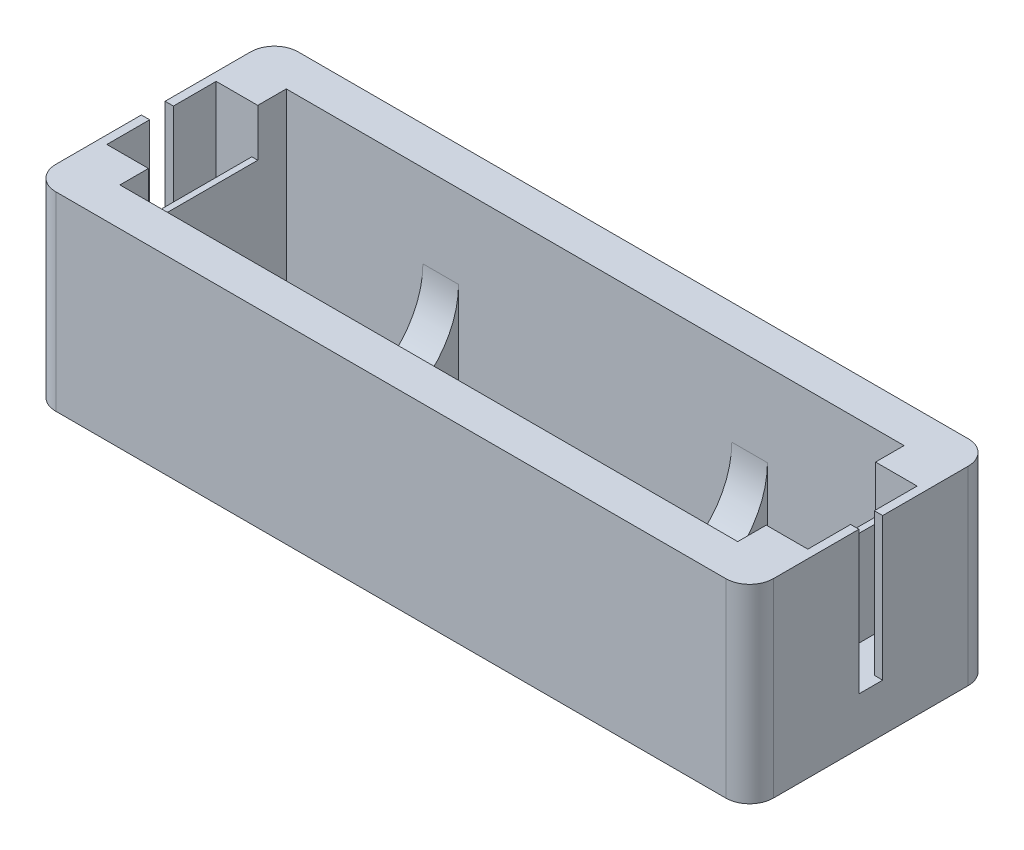
from build123d import *

# Parameters (mm, degrees)
SKETCH2_W                                  = 60.4
SKETCH2_H                                  = 20.4
BOSS_EXTRUDE1_DEPTH                        = 16
SKETCH3_W                                  = 52
SKETCH3_H                                  = 14
CUT_EXTRUDE1_DEPTH                         = 14
FILLET1_R                                  = 2
SKETCH4_W                                  = 0.5
SKETCH4_H                                  = 4.6
CUT_EXTRUDE2_DEPTH                         = 4
SKETCH5_W                                  = 3
SKETCH5_H                                  = 4.6
CUT_EXTRUDE3_DEPTH                         = 12
MIRROR5_COPY_1_SKETCH_W                    = 0.5
MIRROR5_COPY_1_SKETCH_H                    = 4.6
MIRROR5_COPY_1_DEPTH                       = 4
MIRROR5_COPY_2_SKETCH_W                    = 3
MIRROR5_COPY_2_SKETCH_H                    = 4.6
MIRROR5_COPY_2_DEPTH                       = 12
MIRROR5_COPY_3_SKETCH_W                    = 0.5
MIRROR5_COPY_3_SKETCH_H                    = 4.6
MIRROR5_COPY_3_DEPTH                       = 4
SKETCH8_W                                  = 3
SKETCH8_H                                  = 14
BOSS_EXTRUDE2_DEPTH                        = 7
CUT_EXTRUDE5_REACH                         = 49.183
SKETCH7_R                                  = 7
CUT_EXTRUDE5_DIRECTION_2_REACH             = 49.183
SKETCH9_W                                  = 0.7
SKETCH9_H                                  = 1
CUT_EXTRUDE6_DEPTH                         = 12
MIRROR8_AT_THE_SECOND_PLANE_COPY_1_SKETC_W = 0.7
MIRROR8_AT_THE_SECOND_PLANE_COPY_1_SKETC_H = 1
MIRROR8_AT_THE_SECOND_PLANE_COPY_1_DEPTH   = 12


with BuildPart() as part:
    # Sketch2 → Boss-Extrude1 (new body)
    with BuildSketch(Plane(origin=(0, 0, 0), x_dir=(1, 0, 0), z_dir=(0, 1, 0))):
        Rectangle(SKETCH2_W, SKETCH2_H)
    extrude(amount=BOSS_EXTRUDE1_DEPTH)

    # Sketch3 → Cut-Extrude1 (cut)
    with BuildSketch(Plane(origin=(0, 16, 0), x_dir=(1, 0, 0), z_dir=(0, 1, 0))):
        Rectangle(SKETCH3_W, SKETCH3_H)
    extrude(amount=-CUT_EXTRUDE1_DEPTH, mode=Mode.SUBTRACT)

    # Fillet1
    fillet1_edges = [part.edges().sort_by_distance(p)[0] for p in [
        (30.2, 8, 10.2),
        (-30.2, 8, 10.2),
        (-30.2, 8, -10.2),
        (30.2, 8, -10.2),
    ]]
    fillet(fillet1_edges, radius=FILLET1_R)

    # Sketch4 → Cut-Extrude2 (cut)
    with BuildSketch(Plane(origin=(0, 16, 0), x_dir=(1, 0, 0), z_dir=(0, 1, 0))):
        with Locations((-26.25, 2.3)):
            Rectangle(SKETCH4_W, SKETCH4_H)
    cut_extrude2 = extrude(amount=-CUT_EXTRUDE2_DEPTH, mode=Mode.SUBTRACT)

    # Sketch5 → Cut-Extrude3 (cut)
    with BuildSketch(Plane(origin=(0, 16, 0), x_dir=(1, 0, 0), z_dir=(0, 1, 0))):
        with Locations((-28, 2.3)):
            Rectangle(SKETCH5_W, SKETCH5_H)
    cut_extrude3 = extrude(amount=-CUT_EXTRUDE3_DEPTH, mode=Mode.SUBTRACT)

    # Mirror4: Cut-Extrude2, Cut-Extrude3 across plane
    add(cut_extrude2.mirror(Plane(origin=(0, 0, 0), x_dir=(0, 0, 1), z_dir=(1, 0, 0))), mode=Mode.SUBTRACT)
    add(cut_extrude3.mirror(Plane(origin=(0, 0, 0), x_dir=(0, 0, 1), z_dir=(1, 0, 0))), mode=Mode.SUBTRACT)

    # Mirror5: Cut-Extrude3 across plane
    add(cut_extrude3.mirror(Plane.XY), mode=Mode.SUBTRACT)

    # Mirror5 copy 1 sketch → Mirror5 copy 1 (cut)
    with BuildSketch(Plane(origin=(0, 16, 0), x_dir=(-1, 0, 0), z_dir=(0, 1, 0))):
        with Locations((-26.25, 2.3)):
            Rectangle(MIRROR5_COPY_1_SKETCH_W, MIRROR5_COPY_1_SKETCH_H)
    extrude(amount=-MIRROR5_COPY_1_DEPTH, mode=Mode.SUBTRACT)

    # Mirror5 copy 2 sketch → Mirror5 copy 2 (cut)
    with BuildSketch(Plane(origin=(0, 16, 0), x_dir=(-1, 0, 0), z_dir=(0, 1, 0))):
        with Locations((-28, 2.3)):
            Rectangle(MIRROR5_COPY_2_SKETCH_W, MIRROR5_COPY_2_SKETCH_H)
    extrude(amount=-MIRROR5_COPY_2_DEPTH, mode=Mode.SUBTRACT)

    # Mirror5 copy 3 sketch → Mirror5 copy 3 (cut)
    with BuildSketch(Plane(origin=(0, 16, 0), x_dir=(1, 0, 0), z_dir=(0, 1, 0))):
        with Locations((-26.25, -2.3)):
            Rectangle(MIRROR5_COPY_3_SKETCH_W, MIRROR5_COPY_3_SKETCH_H)
    extrude(amount=-MIRROR5_COPY_3_DEPTH, mode=Mode.SUBTRACT)

    # Sketch8 → Boss-Extrude2 (add)
    with BuildSketch(Plane(origin=(0, 2, 0), x_dir=(1, 0, 0), z_dir=(0, 1, 0))):
        with Locations((-13, 0)):
            Rectangle(SKETCH8_W, SKETCH8_H)
    boss_extrude2 = extrude(amount=BOSS_EXTRUDE2_DEPTH)

    # Sketch7 → Cut-Extrude5 (cut, up to next)
    with BuildSketch(Plane(origin=(-13, 0, 0), x_dir=(0, 0, -1), z_dir=(1, 0, 0)), mode=Mode.PRIVATE) as cut_extrude5_sk1:
        with Locations((0, 9)):
            Circle(SKETCH7_R)
    cut_extrude5_tool1 = extrude(cut_extrude5_sk1.sketch, amount=-CUT_EXTRUDE5_REACH, mode=Mode.PRIVATE) & part.part
    cut_extrude5 = cut_extrude5_tool1.solids().sort_by_distance((-13, 9, 0))[0]
    add(cut_extrude5, mode=Mode.SUBTRACT)

    # Sketch7 → Cut-Extrude5 direction 2 (cut, up to next)
    with BuildSketch(Plane(origin=(-13, 0, 0), x_dir=(0, 0, -1), z_dir=(1, 0, 0)), mode=Mode.PRIVATE) as cut_extrude5_direction_2_sk1:
        with Locations((0, 9)):
            Circle(SKETCH7_R)
    cut_extrude5_direction_2_tool1 = extrude(cut_extrude5_direction_2_sk1.sketch, amount=CUT_EXTRUDE5_DIRECTION_2_REACH, mode=Mode.PRIVATE) & part.part
    cut_extrude5_direction_2 = cut_extrude5_direction_2_tool1.solids().sort_by_distance((-13, 9, 0))[0]
    add(cut_extrude5_direction_2, mode=Mode.SUBTRACT)

    # Mirror7: Boss-Extrude2, Cut-Extrude5, Cut-Extrude5 direction 2 across plane
    add(boss_extrude2.mirror(Plane(origin=(0, 0, 0), x_dir=(0, 0, 1), z_dir=(1, 0, 0))))
    add(cut_extrude5.mirror(Plane(origin=(0, 0, 0), x_dir=(0, 0, 1), z_dir=(1, 0, 0))), mode=Mode.SUBTRACT)
    add(cut_extrude5_direction_2.mirror(Plane(origin=(0, 0, 0), x_dir=(0, 0, 1), z_dir=(1, 0, 0))), mode=Mode.SUBTRACT)

    # Sketch9 → Cut-Extrude6 (cut)
    with BuildSketch(Plane(origin=(0, 16, 0), x_dir=(1, 0, 0), z_dir=(0, 1, 0))):
        with Locations((-29.85, 0.5)):
            Rectangle(SKETCH9_W, SKETCH9_H)
    cut_extrude6 = extrude(amount=-CUT_EXTRUDE6_DEPTH, mode=Mode.SUBTRACT)

    # Mirror8: Cut-Extrude6 across plane
    add(cut_extrude6.mirror(Plane.XY), mode=Mode.SUBTRACT)

    # Mirror8 at the second plane: Cut-Extrude6 across plane
    add(cut_extrude6.mirror(Plane(origin=(0, 0, 0), x_dir=(0, 0, 1), z_dir=(1, 0, 0))), mode=Mode.SUBTRACT)

    # Mirror8 at the second plane copy 1 sketc → Mirror8 at the second plane copy 1 (cut)
    with BuildSketch(Plane(origin=(0, 16, 0), x_dir=(-1, 0, 0), z_dir=(0, 1, 0))):
        with Locations((-29.85, 0.5)):
            Rectangle(MIRROR8_AT_THE_SECOND_PLANE_COPY_1_SKETC_W, MIRROR8_AT_THE_SECOND_PLANE_COPY_1_SKETC_H)
    extrude(amount=-MIRROR8_AT_THE_SECOND_PLANE_COPY_1_DEPTH, mode=Mode.SUBTRACT)


solid = part.part
